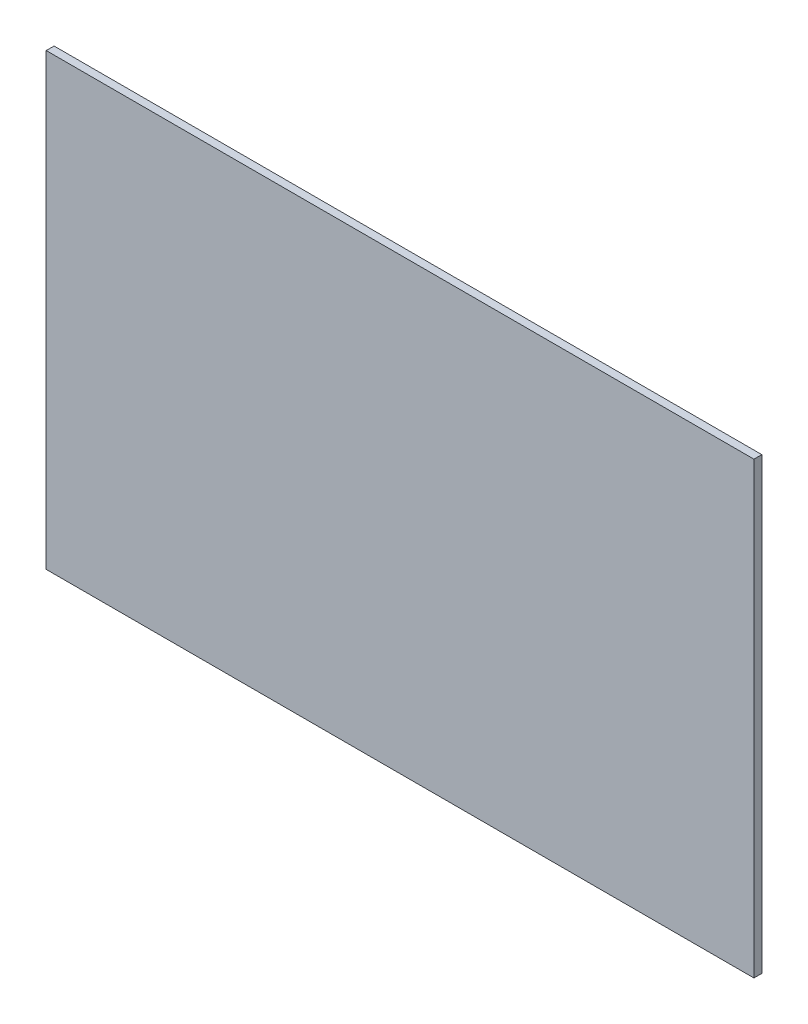
from build123d import *

# Parameters (mm, degrees)
EXTRUDE_1_DEPTH = 7
SKETCH_2_R      = 3
SKETCH_2_R_2    = 0.5
EXTRUDE_2_DEPTH = 7


with BuildPart() as part:
    # 草图1 → 凸台-拉伸1 (new body)
    with BuildSketch(Plane.XY):
        Polygon((0, 0), (630, 0), (630, -400), (0, -400), (0, -18.630210668), align=None)
    extrude(amount=EXTRUDE_1_DEPTH)

    # 草图2 → 凸台-拉伸2 (add)
    with BuildSketch(Plane(origin=(0, 0, 0), x_dir=(-1, 0, 0), z_dir=(0, 0, -1))):
        Polygon((-315.471142347, -300.001109882), (-245.471142347, -300.001109882), (-245.471142347, -250.001109882), (-245.471142347, -230.001109882), (-385.471142347, -230.001109882), (-385.471142347, -300.001109882), align=None)
        with Locations((-315.572226811, -278.546162476)):
            Circle(SKETCH_2_R, mode=Mode.SUBTRACT)
        with Locations((-330.572226811, -278.546162476)):
            Circle(SKETCH_2_R_2, mode=Mode.SUBTRACT)
    extrude(amount=EXTRUDE_2_DEPTH)


solid = part.part
